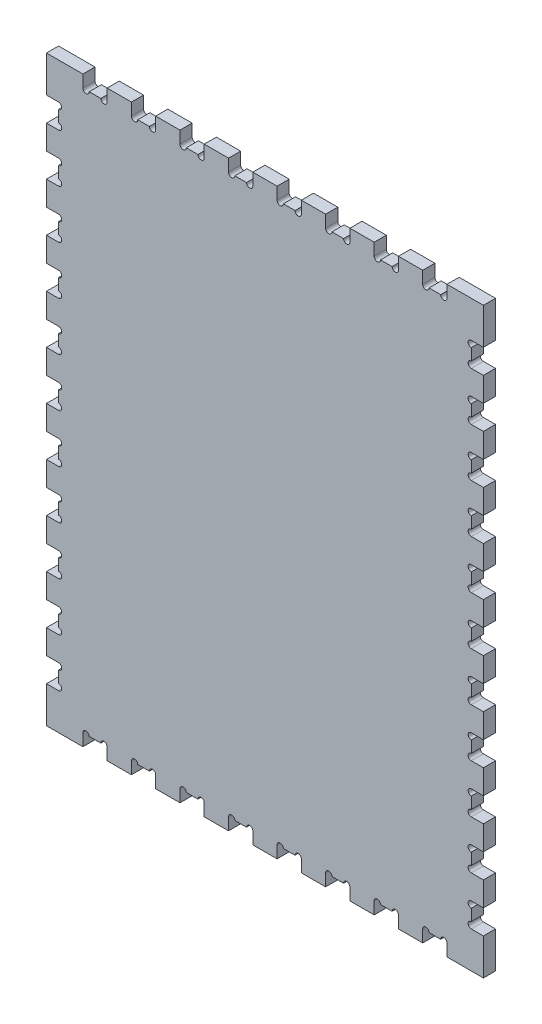
from build123d import *

# Parameters (mm, degrees)
SKETCH1_W                = 457.2
SKETCH1_H                = 609.6
BOSS_EXTRUDE1_DEPTH      = 12.7
CUT_EXTRUDE1_DEPTH       = 382.211607903
LPATTERN1_COUNT          = 8
LPATTERN1_PITCH          = 50.8
SKETCH3_R                = 3.302
SKETCH3_W                = 12.7
SKETCH3_H                = 25.4
CUT_EXTRUDE2_DEPTH       = 382.211607903
LPATTERN2_COUNT          = 11
LPATTERN2_PITCH          = 50.8
MIRROR1_COPY_1_SKETCH_R  = 3.302
MIRROR1_COPY_1_SKETCH_W  = 12.7
MIRROR1_COPY_1_SKETCH_H  = 25.4
MIRROR1_COPY_1_DEPTH     = 382.211607903
MIRROR1_COPY_2_SKETCH_R  = 3.302
MIRROR1_COPY_2_SKETCH_W  = 12.7
MIRROR1_COPY_2_SKETCH_H  = 25.4
MIRROR1_COPY_2_DEPTH     = 382.211607903
MIRROR1_COPY_3_SKETCH_R  = 3.302
MIRROR1_COPY_3_SKETCH_W  = 12.7
MIRROR1_COPY_3_SKETCH_H  = 25.4
MIRROR1_COPY_3_DEPTH     = 382.211607903
MIRROR1_COPY_4_SKETCH_R  = 3.302
MIRROR1_COPY_4_SKETCH_W  = 12.7
MIRROR1_COPY_4_SKETCH_H  = 25.4
MIRROR1_COPY_4_DEPTH     = 382.211607903
MIRROR1_COPY_5_SKETCH_R  = 3.302
MIRROR1_COPY_5_SKETCH_W  = 12.7
MIRROR1_COPY_5_SKETCH_H  = 25.4
MIRROR1_COPY_5_DEPTH     = 382.211607903
MIRROR1_COPY_6_SKETCH_R  = 3.302
MIRROR1_COPY_6_SKETCH_W  = 12.7
MIRROR1_COPY_6_SKETCH_H  = 25.4
MIRROR1_COPY_6_DEPTH     = 382.211607903
MIRROR1_COPY_7_SKETCH_R  = 3.302
MIRROR1_COPY_7_SKETCH_W  = 12.7
MIRROR1_COPY_7_SKETCH_H  = 25.4
MIRROR1_COPY_7_DEPTH     = 382.211607903
MIRROR1_COPY_8_SKETCH_R  = 3.302
MIRROR1_COPY_8_SKETCH_W  = 12.7
MIRROR1_COPY_8_SKETCH_H  = 25.4
MIRROR1_COPY_8_DEPTH     = 382.211607903
MIRROR1_COPY_9_SKETCH_R  = 3.302
MIRROR1_COPY_9_SKETCH_W  = 12.7
MIRROR1_COPY_9_SKETCH_H  = 25.4
MIRROR1_COPY_9_DEPTH     = 382.211607903
MIRROR1_COPY_10_SKETCH_R = 3.302
MIRROR1_COPY_10_SKETCH_W = 12.7
MIRROR1_COPY_10_SKETCH_H = 25.4
MIRROR1_COPY_10_DEPTH    = 382.211607903
MIRROR2_COPY_1_DEPTH     = 382.211607903
MIRROR2_COPY_2_DEPTH     = 382.211607903
MIRROR2_COPY_3_DEPTH     = 382.211607903
MIRROR2_COPY_4_DEPTH     = 382.211607903
MIRROR2_COPY_5_DEPTH     = 382.211607903
MIRROR2_COPY_6_DEPTH     = 382.211607903
MIRROR2_COPY_7_DEPTH     = 382.211607903


with BuildPart() as part:
    # Sketch1 → Boss-Extrude1 (new body)
    with BuildSketch(Plane.XY):
        Rectangle(SKETCH1_W, SKETCH1_H)
    extrude(amount=BOSS_EXTRUDE1_DEPTH)

    # Sketch2 → Cut-Extrude1 (cut, through all)
    with BuildSketch(Plane.XY.offset(12.7)):
        with BuildLine():
            Line((-165.1, 304.8), (-190.5, 304.8))
            Line((-190.5, 304.8), (-190.5, 292.1))
            ThreePointArc((-190.5, 292.1), (-187.198, 295.402), (-183.896, 292.1))
            Line((-183.896, 292.1), (-171.704, 292.1))
            ThreePointArc((-171.704, 292.1), (-168.402, 295.402), (-165.1, 292.1))
            Line((-165.1, 292.1), (-165.1, 304.8))
        make_face()
        with BuildLine():
            ThreePointArc((-183.896, 292.1), (-187.198, 295.402), (-190.5, 292.1))
            Line((-190.5, 292.1), (-183.896, 292.1))
        make_face()
        with BuildLine():
            Line((-183.896, 292.1), (-190.5, 292.1))
            ThreePointArc((-190.5, 292.1), (-187.198, 288.798), (-183.896, 292.1))
        make_face()
        with BuildLine():
            ThreePointArc((-171.704, 292.1), (-168.402, 288.798), (-165.1, 292.1))
            Line((-165.1, 292.1), (-171.704, 292.1))
        make_face()
        with BuildLine():
            Line((-171.704, 292.1), (-165.1, 292.1))
            ThreePointArc((-165.1, 292.1), (-168.402, 295.402), (-171.704, 292.1))
        make_face()
    cut_extrude1 = extrude(amount=-CUT_EXTRUDE1_DEPTH, mode=Mode.SUBTRACT)

    # LPattern1: Cut-Extrude1 ×8
    with Locations(*[(i * LPATTERN1_PITCH, 0, 0) for i in range(1, LPATTERN1_COUNT)]):
        add(cut_extrude1, mode=Mode.SUBTRACT)

    # Sketch3 → Cut-Extrude2 (cut, through all)
    with BuildSketch(Plane.XY.offset(12.7)):
        with Locations((-215.9, 244.602)):
            Circle(SKETCH3_R)
        with Locations((-215.9, 263.398)):
            Circle(SKETCH3_R)
        with Locations((-222.25, 254)):
            Rectangle(SKETCH3_W, SKETCH3_H)
        with BuildLine():
            ThreePointArc((-212.598, 263.398), (-213.565133409, 265.732866591), (-215.9, 266.7))
            Line((-215.9, 266.7), (-215.9, 260.096))
            ThreePointArc((-215.9, 260.096), (-213.565133409, 261.063133409), (-212.598, 263.398))
        make_face()
        with BuildLine():
            Line((-215.9, 260.096), (-215.9, 266.7))
            ThreePointArc((-215.9, 266.7), (-219.202, 263.398), (-215.9, 260.096))
        make_face()
        with BuildLine():
            ThreePointArc((-215.9, 247.904), (-219.202, 244.602), (-215.9, 241.3))
            Line((-215.9, 241.3), (-215.9, 247.904))
        make_face()
        with BuildLine():
            Line((-215.9, 247.904), (-215.9, 241.3))
            ThreePointArc((-215.9, 241.3), (-213.565133409, 242.267133409), (-212.598, 244.602))
            ThreePointArc((-212.598, 244.602), (-213.565133409, 246.936866591), (-215.9, 247.904))
        make_face()
    cut_extrude2 = extrude(amount=-CUT_EXTRUDE2_DEPTH, mode=Mode.SUBTRACT)

    # LPattern2: Cut-Extrude2 ×11
    with Locations(*[(0, -i * LPATTERN2_PITCH, 0) for i in range(1, LPATTERN2_COUNT)]):
        add(cut_extrude2, mode=Mode.SUBTRACT)

    # Mirror1: Cut-Extrude2 across plane
    add(cut_extrude2.mirror(Plane(origin=(0, 0, 0), x_dir=(0, 0, 1), z_dir=(1, 0, 0))), mode=Mode.SUBTRACT)

    # Mirror1 copy 1 sketch → Mirror1 copy 1 (cut, through all)
    with BuildSketch(Plane(origin=(0, -50.8, 12.7), x_dir=(-1, 0, 0), z_dir=(0, 0, 1))):
        with Locations((-215.9, -244.602)):
            Circle(MIRROR1_COPY_1_SKETCH_R)
        with Locations((-215.9, -263.398)):
            Circle(MIRROR1_COPY_1_SKETCH_R)
        with Locations((-222.25, -254)):
            Rectangle(MIRROR1_COPY_1_SKETCH_W, MIRROR1_COPY_1_SKETCH_H)
        with BuildLine():
            ThreePointArc((-212.598, -263.398), (-213.565133409, -265.732866591), (-215.9, -266.7))
            Line((-215.9, -266.7), (-215.9, -260.096))
            ThreePointArc((-215.9, -260.096), (-213.565133409, -261.063133409), (-212.598, -263.398))
        make_face()
        with BuildLine():
            Line((-215.9, -260.096), (-215.9, -266.7))
            ThreePointArc((-215.9, -266.7), (-219.202, -263.398), (-215.9, -260.096))
        make_face()
        with BuildLine():
            ThreePointArc((-215.9, -247.904), (-219.202, -244.602), (-215.9, -241.3))
            Line((-215.9, -241.3), (-215.9, -247.904))
        make_face()
        with BuildLine():
            Line((-215.9, -247.904), (-215.9, -241.3))
            ThreePointArc((-215.9, -241.3), (-213.565133409, -242.267133409), (-212.598, -244.602))
            ThreePointArc((-212.598, -244.602), (-213.565133409, -246.936866591), (-215.9, -247.904))
        make_face()
    extrude(amount=-MIRROR1_COPY_1_DEPTH, mode=Mode.SUBTRACT)

    # Mirror1 copy 2 sketch → Mirror1 copy 2 (cut, through all)
    with BuildSketch(Plane(origin=(0, -101.6, 12.7), x_dir=(-1, 0, 0), z_dir=(0, 0, 1))):
        with Locations((-215.9, -244.602)):
            Circle(MIRROR1_COPY_2_SKETCH_R)
        with Locations((-215.9, -263.398)):
            Circle(MIRROR1_COPY_2_SKETCH_R)
        with Locations((-222.25, -254)):
            Rectangle(MIRROR1_COPY_2_SKETCH_W, MIRROR1_COPY_2_SKETCH_H)
        with BuildLine():
            ThreePointArc((-212.598, -263.398), (-213.565133409, -265.732866591), (-215.9, -266.7))
            Line((-215.9, -266.7), (-215.9, -260.096))
            ThreePointArc((-215.9, -260.096), (-213.565133409, -261.063133409), (-212.598, -263.398))
        make_face()
        with BuildLine():
            Line((-215.9, -260.096), (-215.9, -266.7))
            ThreePointArc((-215.9, -266.7), (-219.202, -263.398), (-215.9, -260.096))
        make_face()
        with BuildLine():
            ThreePointArc((-215.9, -247.904), (-219.202, -244.602), (-215.9, -241.3))
            Line((-215.9, -241.3), (-215.9, -247.904))
        make_face()
        with BuildLine():
            Line((-215.9, -247.904), (-215.9, -241.3))
            ThreePointArc((-215.9, -241.3), (-213.565133409, -242.267133409), (-212.598, -244.602))
            ThreePointArc((-212.598, -244.602), (-213.565133409, -246.936866591), (-215.9, -247.904))
        make_face()
    extrude(amount=-MIRROR1_COPY_2_DEPTH, mode=Mode.SUBTRACT)

    # Mirror1 copy 3 sketch → Mirror1 copy 3 (cut, through all)
    with BuildSketch(Plane(origin=(0, -152.4, 12.7), x_dir=(-1, 0, 0), z_dir=(0, 0, 1))):
        with Locations((-215.9, -244.602)):
            Circle(MIRROR1_COPY_3_SKETCH_R)
        with Locations((-215.9, -263.398)):
            Circle(MIRROR1_COPY_3_SKETCH_R)
        with Locations((-222.25, -254)):
            Rectangle(MIRROR1_COPY_3_SKETCH_W, MIRROR1_COPY_3_SKETCH_H)
        with BuildLine():
            ThreePointArc((-212.598, -263.398), (-213.565133409, -265.732866591), (-215.9, -266.7))
            Line((-215.9, -266.7), (-215.9, -260.096))
            ThreePointArc((-215.9, -260.096), (-213.565133409, -261.063133409), (-212.598, -263.398))
        make_face()
        with BuildLine():
            Line((-215.9, -260.096), (-215.9, -266.7))
            ThreePointArc((-215.9, -266.7), (-219.202, -263.398), (-215.9, -260.096))
        make_face()
        with BuildLine():
            ThreePointArc((-215.9, -247.904), (-219.202, -244.602), (-215.9, -241.3))
            Line((-215.9, -241.3), (-215.9, -247.904))
        make_face()
        with BuildLine():
            Line((-215.9, -247.904), (-215.9, -241.3))
            ThreePointArc((-215.9, -241.3), (-213.565133409, -242.267133409), (-212.598, -244.602))
            ThreePointArc((-212.598, -244.602), (-213.565133409, -246.936866591), (-215.9, -247.904))
        make_face()
    extrude(amount=-MIRROR1_COPY_3_DEPTH, mode=Mode.SUBTRACT)

    # Mirror1 copy 4 sketch → Mirror1 copy 4 (cut, through all)
    with BuildSketch(Plane(origin=(0, -203.2, 12.7), x_dir=(-1, 0, 0), z_dir=(0, 0, 1))):
        with Locations((-215.9, -244.602)):
            Circle(MIRROR1_COPY_4_SKETCH_R)
        with Locations((-215.9, -263.398)):
            Circle(MIRROR1_COPY_4_SKETCH_R)
        with Locations((-222.25, -254)):
            Rectangle(MIRROR1_COPY_4_SKETCH_W, MIRROR1_COPY_4_SKETCH_H)
        with BuildLine():
            ThreePointArc((-212.598, -263.398), (-213.565133409, -265.732866591), (-215.9, -266.7))
            Line((-215.9, -266.7), (-215.9, -260.096))
            ThreePointArc((-215.9, -260.096), (-213.565133409, -261.063133409), (-212.598, -263.398))
        make_face()
        with BuildLine():
            Line((-215.9, -260.096), (-215.9, -266.7))
            ThreePointArc((-215.9, -266.7), (-219.202, -263.398), (-215.9, -260.096))
        make_face()
        with BuildLine():
            ThreePointArc((-215.9, -247.904), (-219.202, -244.602), (-215.9, -241.3))
            Line((-215.9, -241.3), (-215.9, -247.904))
        make_face()
        with BuildLine():
            Line((-215.9, -247.904), (-215.9, -241.3))
            ThreePointArc((-215.9, -241.3), (-213.565133409, -242.267133409), (-212.598, -244.602))
            ThreePointArc((-212.598, -244.602), (-213.565133409, -246.936866591), (-215.9, -247.904))
        make_face()
    extrude(amount=-MIRROR1_COPY_4_DEPTH, mode=Mode.SUBTRACT)

    # Mirror1 copy 5 sketch → Mirror1 copy 5 (cut, through all)
    with BuildSketch(Plane(origin=(0, -254, 12.7), x_dir=(-1, 0, 0), z_dir=(0, 0, 1))):
        with Locations((-215.9, -244.602)):
            Circle(MIRROR1_COPY_5_SKETCH_R)
        with Locations((-215.9, -263.398)):
            Circle(MIRROR1_COPY_5_SKETCH_R)
        with Locations((-222.25, -254)):
            Rectangle(MIRROR1_COPY_5_SKETCH_W, MIRROR1_COPY_5_SKETCH_H)
        with BuildLine():
            ThreePointArc((-212.598, -263.398), (-213.565133409, -265.732866591), (-215.9, -266.7))
            Line((-215.9, -266.7), (-215.9, -260.096))
            ThreePointArc((-215.9, -260.096), (-213.565133409, -261.063133409), (-212.598, -263.398))
        make_face()
        with BuildLine():
            Line((-215.9, -260.096), (-215.9, -266.7))
            ThreePointArc((-215.9, -266.7), (-219.202, -263.398), (-215.9, -260.096))
        make_face()
        with BuildLine():
            ThreePointArc((-215.9, -247.904), (-219.202, -244.602), (-215.9, -241.3))
            Line((-215.9, -241.3), (-215.9, -247.904))
        make_face()
        with BuildLine():
            Line((-215.9, -247.904), (-215.9, -241.3))
            ThreePointArc((-215.9, -241.3), (-213.565133409, -242.267133409), (-212.598, -244.602))
            ThreePointArc((-212.598, -244.602), (-213.565133409, -246.936866591), (-215.9, -247.904))
        make_face()
    extrude(amount=-MIRROR1_COPY_5_DEPTH, mode=Mode.SUBTRACT)

    # Mirror1 copy 6 sketch → Mirror1 copy 6 (cut, through all)
    with BuildSketch(Plane(origin=(0, -304.8, 12.7), x_dir=(-1, 0, 0), z_dir=(0, 0, 1))):
        with Locations((-215.9, -244.602)):
            Circle(MIRROR1_COPY_6_SKETCH_R)
        with Locations((-215.9, -263.398)):
            Circle(MIRROR1_COPY_6_SKETCH_R)
        with Locations((-222.25, -254)):
            Rectangle(MIRROR1_COPY_6_SKETCH_W, MIRROR1_COPY_6_SKETCH_H)
        with BuildLine():
            ThreePointArc((-212.598, -263.398), (-213.565133409, -265.732866591), (-215.9, -266.7))
            Line((-215.9, -266.7), (-215.9, -260.096))
            ThreePointArc((-215.9, -260.096), (-213.565133409, -261.063133409), (-212.598, -263.398))
        make_face()
        with BuildLine():
            Line((-215.9, -260.096), (-215.9, -266.7))
            ThreePointArc((-215.9, -266.7), (-219.202, -263.398), (-215.9, -260.096))
        make_face()
        with BuildLine():
            ThreePointArc((-215.9, -247.904), (-219.202, -244.602), (-215.9, -241.3))
            Line((-215.9, -241.3), (-215.9, -247.904))
        make_face()
        with BuildLine():
            Line((-215.9, -247.904), (-215.9, -241.3))
            ThreePointArc((-215.9, -241.3), (-213.565133409, -242.267133409), (-212.598, -244.602))
            ThreePointArc((-212.598, -244.602), (-213.565133409, -246.936866591), (-215.9, -247.904))
        make_face()
    extrude(amount=-MIRROR1_COPY_6_DEPTH, mode=Mode.SUBTRACT)

    # Mirror1 copy 7 sketch → Mirror1 copy 7 (cut, through all)
    with BuildSketch(Plane(origin=(0, -355.6, 12.7), x_dir=(-1, 0, 0), z_dir=(0, 0, 1))):
        with Locations((-215.9, -244.602)):
            Circle(MIRROR1_COPY_7_SKETCH_R)
        with Locations((-215.9, -263.398)):
            Circle(MIRROR1_COPY_7_SKETCH_R)
        with Locations((-222.25, -254)):
            Rectangle(MIRROR1_COPY_7_SKETCH_W, MIRROR1_COPY_7_SKETCH_H)
        with BuildLine():
            ThreePointArc((-212.598, -263.398), (-213.565133409, -265.732866591), (-215.9, -266.7))
            Line((-215.9, -266.7), (-215.9, -260.096))
            ThreePointArc((-215.9, -260.096), (-213.565133409, -261.063133409), (-212.598, -263.398))
        make_face()
        with BuildLine():
            Line((-215.9, -260.096), (-215.9, -266.7))
            ThreePointArc((-215.9, -266.7), (-219.202, -263.398), (-215.9, -260.096))
        make_face()
        with BuildLine():
            ThreePointArc((-215.9, -247.904), (-219.202, -244.602), (-215.9, -241.3))
            Line((-215.9, -241.3), (-215.9, -247.904))
        make_face()
        with BuildLine():
            Line((-215.9, -247.904), (-215.9, -241.3))
            ThreePointArc((-215.9, -241.3), (-213.565133409, -242.267133409), (-212.598, -244.602))
            ThreePointArc((-212.598, -244.602), (-213.565133409, -246.936866591), (-215.9, -247.904))
        make_face()
    extrude(amount=-MIRROR1_COPY_7_DEPTH, mode=Mode.SUBTRACT)

    # Mirror1 copy 8 sketch → Mirror1 copy 8 (cut, through all)
    with BuildSketch(Plane(origin=(0, -406.4, 12.7), x_dir=(-1, 0, 0), z_dir=(0, 0, 1))):
        with Locations((-215.9, -244.602)):
            Circle(MIRROR1_COPY_8_SKETCH_R)
        with Locations((-215.9, -263.398)):
            Circle(MIRROR1_COPY_8_SKETCH_R)
        with Locations((-222.25, -254)):
            Rectangle(MIRROR1_COPY_8_SKETCH_W, MIRROR1_COPY_8_SKETCH_H)
        with BuildLine():
            ThreePointArc((-212.598, -263.398), (-213.565133409, -265.732866591), (-215.9, -266.7))
            Line((-215.9, -266.7), (-215.9, -260.096))
            ThreePointArc((-215.9, -260.096), (-213.565133409, -261.063133409), (-212.598, -263.398))
        make_face()
        with BuildLine():
            Line((-215.9, -260.096), (-215.9, -266.7))
            ThreePointArc((-215.9, -266.7), (-219.202, -263.398), (-215.9, -260.096))
        make_face()
        with BuildLine():
            ThreePointArc((-215.9, -247.904), (-219.202, -244.602), (-215.9, -241.3))
            Line((-215.9, -241.3), (-215.9, -247.904))
        make_face()
        with BuildLine():
            Line((-215.9, -247.904), (-215.9, -241.3))
            ThreePointArc((-215.9, -241.3), (-213.565133409, -242.267133409), (-212.598, -244.602))
            ThreePointArc((-212.598, -244.602), (-213.565133409, -246.936866591), (-215.9, -247.904))
        make_face()
    extrude(amount=-MIRROR1_COPY_8_DEPTH, mode=Mode.SUBTRACT)

    # Mirror1 copy 9 sketch → Mirror1 copy 9 (cut, through all)
    with BuildSketch(Plane(origin=(0, -457.2, 12.7), x_dir=(-1, 0, 0), z_dir=(0, 0, 1))):
        with Locations((-215.9, -244.602)):
            Circle(MIRROR1_COPY_9_SKETCH_R)
        with Locations((-215.9, -263.398)):
            Circle(MIRROR1_COPY_9_SKETCH_R)
        with Locations((-222.25, -254)):
            Rectangle(MIRROR1_COPY_9_SKETCH_W, MIRROR1_COPY_9_SKETCH_H)
        with BuildLine():
            ThreePointArc((-212.598, -263.398), (-213.565133409, -265.732866591), (-215.9, -266.7))
            Line((-215.9, -266.7), (-215.9, -260.096))
            ThreePointArc((-215.9, -260.096), (-213.565133409, -261.063133409), (-212.598, -263.398))
        make_face()
        with BuildLine():
            Line((-215.9, -260.096), (-215.9, -266.7))
            ThreePointArc((-215.9, -266.7), (-219.202, -263.398), (-215.9, -260.096))
        make_face()
        with BuildLine():
            ThreePointArc((-215.9, -247.904), (-219.202, -244.602), (-215.9, -241.3))
            Line((-215.9, -241.3), (-215.9, -247.904))
        make_face()
        with BuildLine():
            Line((-215.9, -247.904), (-215.9, -241.3))
            ThreePointArc((-215.9, -241.3), (-213.565133409, -242.267133409), (-212.598, -244.602))
            ThreePointArc((-212.598, -244.602), (-213.565133409, -246.936866591), (-215.9, -247.904))
        make_face()
    extrude(amount=-MIRROR1_COPY_9_DEPTH, mode=Mode.SUBTRACT)

    # Mirror1 copy 10 sketch → Mirror1 copy 10 (cut, through all)
    with BuildSketch(Plane(origin=(0, -508, 12.7), x_dir=(-1, 0, 0), z_dir=(0, 0, 1))):
        with Locations((-215.9, -244.602)):
            Circle(MIRROR1_COPY_10_SKETCH_R)
        with Locations((-215.9, -263.398)):
            Circle(MIRROR1_COPY_10_SKETCH_R)
        with Locations((-222.25, -254)):
            Rectangle(MIRROR1_COPY_10_SKETCH_W, MIRROR1_COPY_10_SKETCH_H)
        with BuildLine():
            ThreePointArc((-212.598, -263.398), (-213.565133409, -265.732866591), (-215.9, -266.7))
            Line((-215.9, -266.7), (-215.9, -260.096))
            ThreePointArc((-215.9, -260.096), (-213.565133409, -261.063133409), (-212.598, -263.398))
        make_face()
        with BuildLine():
            Line((-215.9, -260.096), (-215.9, -266.7))
            ThreePointArc((-215.9, -266.7), (-219.202, -263.398), (-215.9, -260.096))
        make_face()
        with BuildLine():
            ThreePointArc((-215.9, -247.904), (-219.202, -244.602), (-215.9, -241.3))
            Line((-215.9, -241.3), (-215.9, -247.904))
        make_face()
        with BuildLine():
            Line((-215.9, -247.904), (-215.9, -241.3))
            ThreePointArc((-215.9, -241.3), (-213.565133409, -242.267133409), (-212.598, -244.602))
            ThreePointArc((-212.598, -244.602), (-213.565133409, -246.936866591), (-215.9, -247.904))
        make_face()
    extrude(amount=-MIRROR1_COPY_10_DEPTH, mode=Mode.SUBTRACT)

    # Mirror2: Cut-Extrude1 across plane
    add(cut_extrude1.mirror(Plane.ZX), mode=Mode.SUBTRACT)

    # Mirror2 copy 1 sketch → Mirror2 copy 1 (cut, through all)
    with BuildSketch(Plane(origin=(50.8, 0, 12.7), x_dir=(1, 0, 0), z_dir=(0, 0, 1))):
        with BuildLine():
            Line((-165.1, -304.8), (-190.5, -304.8))
            Line((-190.5, -304.8), (-190.5, -292.1))
            ThreePointArc((-190.5, -292.1), (-187.198, -295.402), (-183.896, -292.1))
            Line((-183.896, -292.1), (-171.704, -292.1))
            ThreePointArc((-171.704, -292.1), (-168.402, -295.402), (-165.1, -292.1))
            Line((-165.1, -292.1), (-165.1, -304.8))
        make_face()
        with BuildLine():
            ThreePointArc((-183.896, -292.1), (-187.198, -295.402), (-190.5, -292.1))
            Line((-190.5, -292.1), (-183.896, -292.1))
        make_face()
        with BuildLine():
            Line((-183.896, -292.1), (-190.5, -292.1))
            ThreePointArc((-190.5, -292.1), (-187.198, -288.798), (-183.896, -292.1))
        make_face()
        with BuildLine():
            ThreePointArc((-171.704, -292.1), (-168.402, -288.798), (-165.1, -292.1))
            Line((-165.1, -292.1), (-171.704, -292.1))
        make_face()
        with BuildLine():
            Line((-171.704, -292.1), (-165.1, -292.1))
            ThreePointArc((-165.1, -292.1), (-168.402, -295.402), (-171.704, -292.1))
        make_face()
    extrude(amount=-MIRROR2_COPY_1_DEPTH, mode=Mode.SUBTRACT)

    # Mirror2 copy 2 sketch → Mirror2 copy 2 (cut, through all)
    with BuildSketch(Plane(origin=(101.6, 0, 12.7), x_dir=(1, 0, 0), z_dir=(0, 0, 1))):
        with BuildLine():
            Line((-165.1, -304.8), (-190.5, -304.8))
            Line((-190.5, -304.8), (-190.5, -292.1))
            ThreePointArc((-190.5, -292.1), (-187.198, -295.402), (-183.896, -292.1))
            Line((-183.896, -292.1), (-171.704, -292.1))
            ThreePointArc((-171.704, -292.1), (-168.402, -295.402), (-165.1, -292.1))
            Line((-165.1, -292.1), (-165.1, -304.8))
        make_face()
        with BuildLine():
            ThreePointArc((-183.896, -292.1), (-187.198, -295.402), (-190.5, -292.1))
            Line((-190.5, -292.1), (-183.896, -292.1))
        make_face()
        with BuildLine():
            Line((-183.896, -292.1), (-190.5, -292.1))
            ThreePointArc((-190.5, -292.1), (-187.198, -288.798), (-183.896, -292.1))
        make_face()
        with BuildLine():
            ThreePointArc((-171.704, -292.1), (-168.402, -288.798), (-165.1, -292.1))
            Line((-165.1, -292.1), (-171.704, -292.1))
        make_face()
        with BuildLine():
            Line((-171.704, -292.1), (-165.1, -292.1))
            ThreePointArc((-165.1, -292.1), (-168.402, -295.402), (-171.704, -292.1))
        make_face()
    extrude(amount=-MIRROR2_COPY_2_DEPTH, mode=Mode.SUBTRACT)

    # Mirror2 copy 3 sketch → Mirror2 copy 3 (cut, through all)
    with BuildSketch(Plane(origin=(152.4, 0, 12.7), x_dir=(1, 0, 0), z_dir=(0, 0, 1))):
        with BuildLine():
            Line((-165.1, -304.8), (-190.5, -304.8))
            Line((-190.5, -304.8), (-190.5, -292.1))
            ThreePointArc((-190.5, -292.1), (-187.198, -295.402), (-183.896, -292.1))
            Line((-183.896, -292.1), (-171.704, -292.1))
            ThreePointArc((-171.704, -292.1), (-168.402, -295.402), (-165.1, -292.1))
            Line((-165.1, -292.1), (-165.1, -304.8))
        make_face()
        with BuildLine():
            ThreePointArc((-183.896, -292.1), (-187.198, -295.402), (-190.5, -292.1))
            Line((-190.5, -292.1), (-183.896, -292.1))
        make_face()
        with BuildLine():
            Line((-183.896, -292.1), (-190.5, -292.1))
            ThreePointArc((-190.5, -292.1), (-187.198, -288.798), (-183.896, -292.1))
        make_face()
        with BuildLine():
            ThreePointArc((-171.704, -292.1), (-168.402, -288.798), (-165.1, -292.1))
            Line((-165.1, -292.1), (-171.704, -292.1))
        make_face()
        with BuildLine():
            Line((-171.704, -292.1), (-165.1, -292.1))
            ThreePointArc((-165.1, -292.1), (-168.402, -295.402), (-171.704, -292.1))
        make_face()
    extrude(amount=-MIRROR2_COPY_3_DEPTH, mode=Mode.SUBTRACT)

    # Mirror2 copy 4 sketch → Mirror2 copy 4 (cut, through all)
    with BuildSketch(Plane(origin=(203.2, 0, 12.7), x_dir=(1, 0, 0), z_dir=(0, 0, 1))):
        with BuildLine():
            Line((-165.1, -304.8), (-190.5, -304.8))
            Line((-190.5, -304.8), (-190.5, -292.1))
            ThreePointArc((-190.5, -292.1), (-187.198, -295.402), (-183.896, -292.1))
            Line((-183.896, -292.1), (-171.704, -292.1))
            ThreePointArc((-171.704, -292.1), (-168.402, -295.402), (-165.1, -292.1))
            Line((-165.1, -292.1), (-165.1, -304.8))
        make_face()
        with BuildLine():
            ThreePointArc((-183.896, -292.1), (-187.198, -295.402), (-190.5, -292.1))
            Line((-190.5, -292.1), (-183.896, -292.1))
        make_face()
        with BuildLine():
            Line((-183.896, -292.1), (-190.5, -292.1))
            ThreePointArc((-190.5, -292.1), (-187.198, -288.798), (-183.896, -292.1))
        make_face()
        with BuildLine():
            ThreePointArc((-171.704, -292.1), (-168.402, -288.798), (-165.1, -292.1))
            Line((-165.1, -292.1), (-171.704, -292.1))
        make_face()
        with BuildLine():
            Line((-171.704, -292.1), (-165.1, -292.1))
            ThreePointArc((-165.1, -292.1), (-168.402, -295.402), (-171.704, -292.1))
        make_face()
    extrude(amount=-MIRROR2_COPY_4_DEPTH, mode=Mode.SUBTRACT)

    # Mirror2 copy 5 sketch → Mirror2 copy 5 (cut, through all)
    with BuildSketch(Plane(origin=(254, 0, 12.7), x_dir=(1, 0, 0), z_dir=(0, 0, 1))):
        with BuildLine():
            Line((-165.1, -304.8), (-190.5, -304.8))
            Line((-190.5, -304.8), (-190.5, -292.1))
            ThreePointArc((-190.5, -292.1), (-187.198, -295.402), (-183.896, -292.1))
            Line((-183.896, -292.1), (-171.704, -292.1))
            ThreePointArc((-171.704, -292.1), (-168.402, -295.402), (-165.1, -292.1))
            Line((-165.1, -292.1), (-165.1, -304.8))
        make_face()
        with BuildLine():
            ThreePointArc((-183.896, -292.1), (-187.198, -295.402), (-190.5, -292.1))
            Line((-190.5, -292.1), (-183.896, -292.1))
        make_face()
        with BuildLine():
            Line((-183.896, -292.1), (-190.5, -292.1))
            ThreePointArc((-190.5, -292.1), (-187.198, -288.798), (-183.896, -292.1))
        make_face()
        with BuildLine():
            ThreePointArc((-171.704, -292.1), (-168.402, -288.798), (-165.1, -292.1))
            Line((-165.1, -292.1), (-171.704, -292.1))
        make_face()
        with BuildLine():
            Line((-171.704, -292.1), (-165.1, -292.1))
            ThreePointArc((-165.1, -292.1), (-168.402, -295.402), (-171.704, -292.1))
        make_face()
    extrude(amount=-MIRROR2_COPY_5_DEPTH, mode=Mode.SUBTRACT)

    # Mirror2 copy 6 sketch → Mirror2 copy 6 (cut, through all)
    with BuildSketch(Plane(origin=(304.8, 0, 12.7), x_dir=(1, 0, 0), z_dir=(0, 0, 1))):
        with BuildLine():
            Line((-165.1, -304.8), (-190.5, -304.8))
            Line((-190.5, -304.8), (-190.5, -292.1))
            ThreePointArc((-190.5, -292.1), (-187.198, -295.402), (-183.896, -292.1))
            Line((-183.896, -292.1), (-171.704, -292.1))
            ThreePointArc((-171.704, -292.1), (-168.402, -295.402), (-165.1, -292.1))
            Line((-165.1, -292.1), (-165.1, -304.8))
        make_face()
        with BuildLine():
            ThreePointArc((-183.896, -292.1), (-187.198, -295.402), (-190.5, -292.1))
            Line((-190.5, -292.1), (-183.896, -292.1))
        make_face()
        with BuildLine():
            Line((-183.896, -292.1), (-190.5, -292.1))
            ThreePointArc((-190.5, -292.1), (-187.198, -288.798), (-183.896, -292.1))
        make_face()
        with BuildLine():
            ThreePointArc((-171.704, -292.1), (-168.402, -288.798), (-165.1, -292.1))
            Line((-165.1, -292.1), (-171.704, -292.1))
        make_face()
        with BuildLine():
            Line((-171.704, -292.1), (-165.1, -292.1))
            ThreePointArc((-165.1, -292.1), (-168.402, -295.402), (-171.704, -292.1))
        make_face()
    extrude(amount=-MIRROR2_COPY_6_DEPTH, mode=Mode.SUBTRACT)

    # Mirror2 copy 7 sketch → Mirror2 copy 7 (cut, through all)
    with BuildSketch(Plane(origin=(355.6, 0, 12.7), x_dir=(1, 0, 0), z_dir=(0, 0, 1))):
        with BuildLine():
            Line((-165.1, -304.8), (-190.5, -304.8))
            Line((-190.5, -304.8), (-190.5, -292.1))
            ThreePointArc((-190.5, -292.1), (-187.198, -295.402), (-183.896, -292.1))
            Line((-183.896, -292.1), (-171.704, -292.1))
            ThreePointArc((-171.704, -292.1), (-168.402, -295.402), (-165.1, -292.1))
            Line((-165.1, -292.1), (-165.1, -304.8))
        make_face()
        with BuildLine():
            ThreePointArc((-183.896, -292.1), (-187.198, -295.402), (-190.5, -292.1))
            Line((-190.5, -292.1), (-183.896, -292.1))
        make_face()
        with BuildLine():
            Line((-183.896, -292.1), (-190.5, -292.1))
            ThreePointArc((-190.5, -292.1), (-187.198, -288.798), (-183.896, -292.1))
        make_face()
        with BuildLine():
            ThreePointArc((-171.704, -292.1), (-168.402, -288.798), (-165.1, -292.1))
            Line((-165.1, -292.1), (-171.704, -292.1))
        make_face()
        with BuildLine():
            Line((-171.704, -292.1), (-165.1, -292.1))
            ThreePointArc((-165.1, -292.1), (-168.402, -295.402), (-171.704, -292.1))
        make_face()
    extrude(amount=-MIRROR2_COPY_7_DEPTH, mode=Mode.SUBTRACT)


solid = part.part
